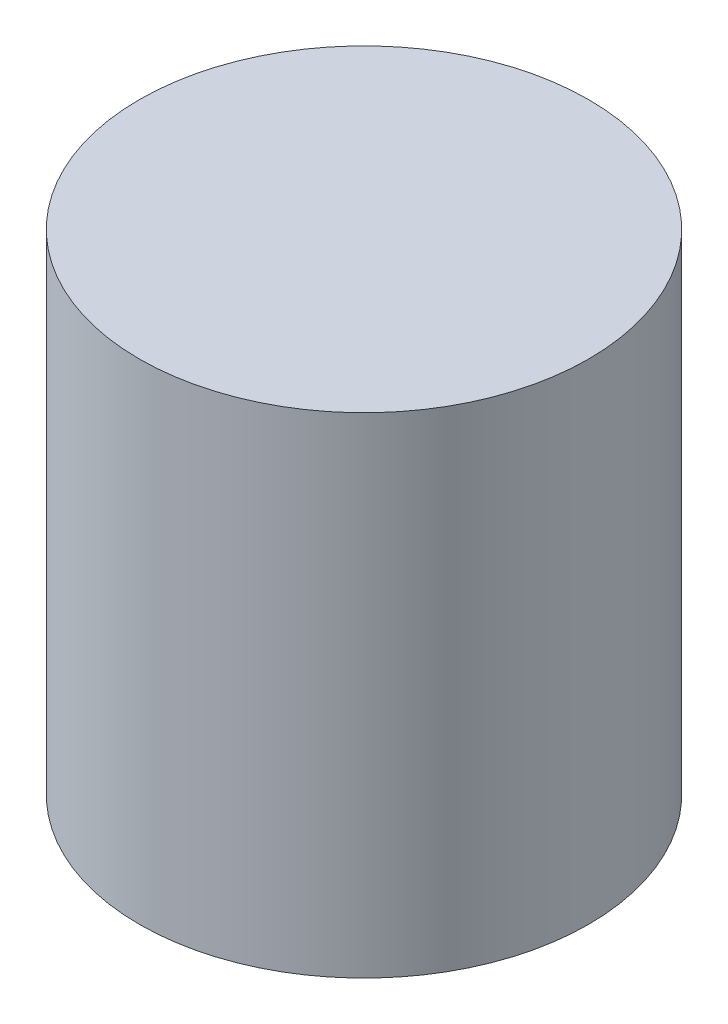
from build123d import *

# Parameters (mm, degrees)
SKETCH1_R           = 15.600223339
BOSS_EXTRUDE1_DEPTH = 34


with BuildPart() as part:
    # Sketch1 → Boss-Extrude1 (new body)
    with BuildSketch(Plane(origin=(0, 0, 0), x_dir=(1, 0, 0), z_dir=(0, 1, 0))):
        with Locations(Location((0, 0, 0), (0, 0, 270))):
            Circle(SKETCH1_R)
    extrude(amount=BOSS_EXTRUDE1_DEPTH)


solid = part.part
